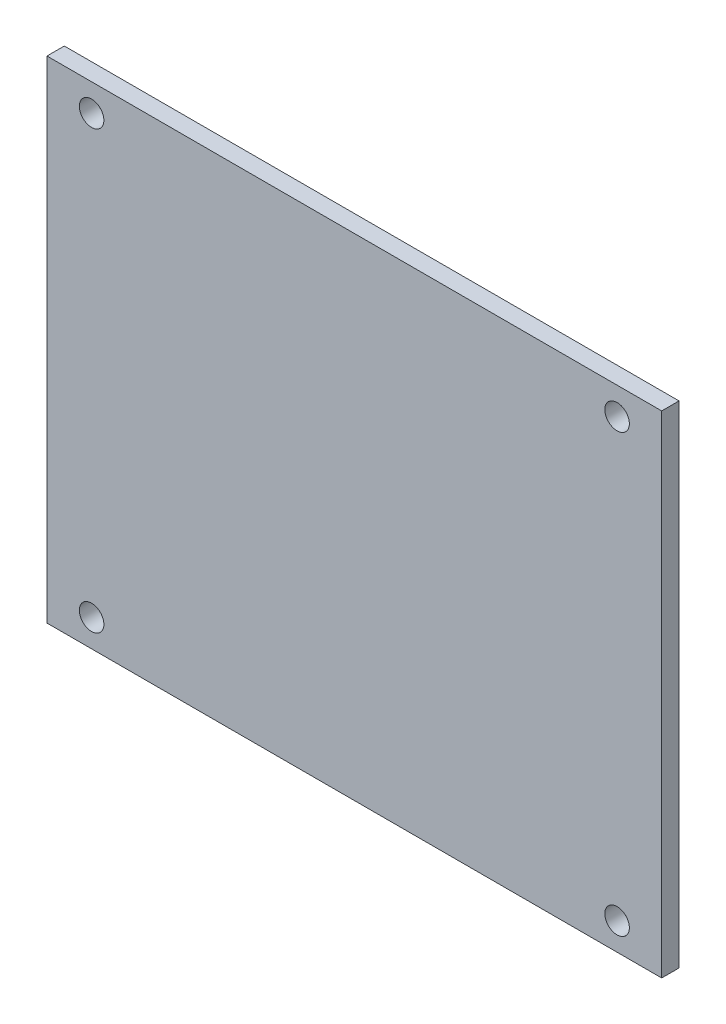
from build123d import *

# Parameters (mm, degrees)
SKETCH1_W                            = 112.65
SKETCH1_H                            = 90
BOSS_EXTRUDE1_DEPTH                  = 3.175
M4_CLEARANCE_HOLE1_D                 = 4.5
MIRROR1_AT_THE_SECOND_PLANE_COPY_1_D = 4.5


with BuildPart() as part:
    # Sketch1 → Boss-Extrude1 (new body)
    with BuildSketch(Plane.XY):
        Rectangle(SKETCH1_W, SKETCH1_H)
    extrude(amount=BOSS_EXTRUDE1_DEPTH)

    # M4 Clearance Hole1 (through all)
    with Locations(Plane.XY.offset(3.175)):
        with Locations((-48.15, -40)):
            m4_clearance_hole1 = Hole(M4_CLEARANCE_HOLE1_D / 2)

    # Mirror1: M4 Clearance Hole1 across plane
    add(m4_clearance_hole1.mirror(Plane(origin=(0, 0, 0), x_dir=(0, 0, 1), z_dir=(1, 0, 0))), mode=Mode.SUBTRACT)

    # Mirror1 at the second plane: M4 Clearance Hole1 across plane
    add(m4_clearance_hole1.mirror(Plane.ZX), mode=Mode.SUBTRACT)

    # Mirror1 at the second plane copy 1 (through all)
    with Locations(Plane(origin=(0, 0, 3.175), x_dir=(-1, 0, 0), z_dir=(0, 0, 1))):
        with Locations((-48.15, -40)):
            Hole(MIRROR1_AT_THE_SECOND_PLANE_COPY_1_D / 2)


solid = part.part
